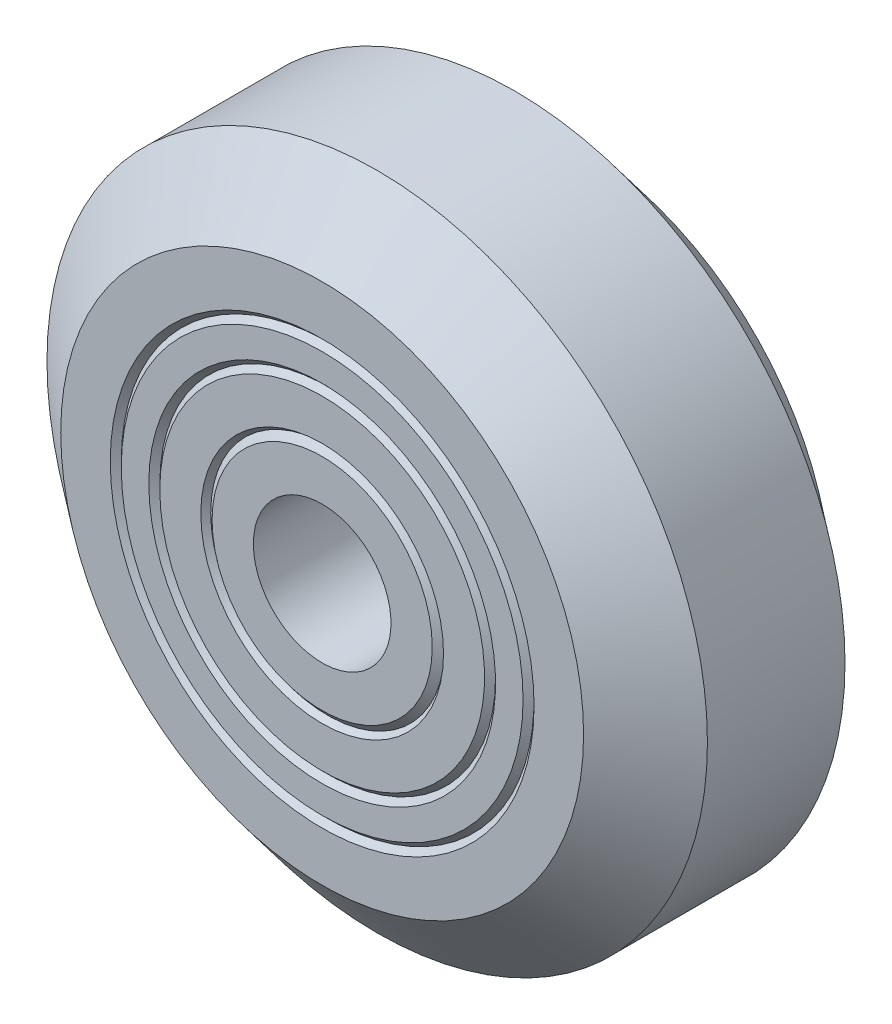
from build123d import *


with BuildPart() as part:
    # Sketch1 → Revolve1 (revolve)
    with BuildSketch(Plane(origin=(0, 0, 0), x_dir=(0, 0, -1), z_dir=(1, 0, 0)), mode=Mode.PRIVATE) as revolve1_sk:
        Polygon((-4.5, 7.3), (-4.5, 6.3), (-4.3, 6.1), (-4.5, 5.9), (-4.5, 4.41), (-4.3, 4.25), (-4.5, 4), (-4.5, 2.5), (0, 2.5), (0, 12), (-2.5, 12), (-4.5, 9.5), (-4.5, 7.7), (-4.3, 7.5), align=None)
    revolve(revolve1_sk.sketch.rotate(Axis((0, 0, 0), (0, 0, 1)), 90), axis=Axis((0, 0, 0), (0, 0, 1)))

    # Mirror1: part across plane


with BuildPart() as part_1:
    add(part.part)
    add(part.part.mirror(Plane(origin=(0, 2.5, 0), x_dir=(1, 0, 0), z_dir=(0, 0, -1))))


solid = part_1.part
